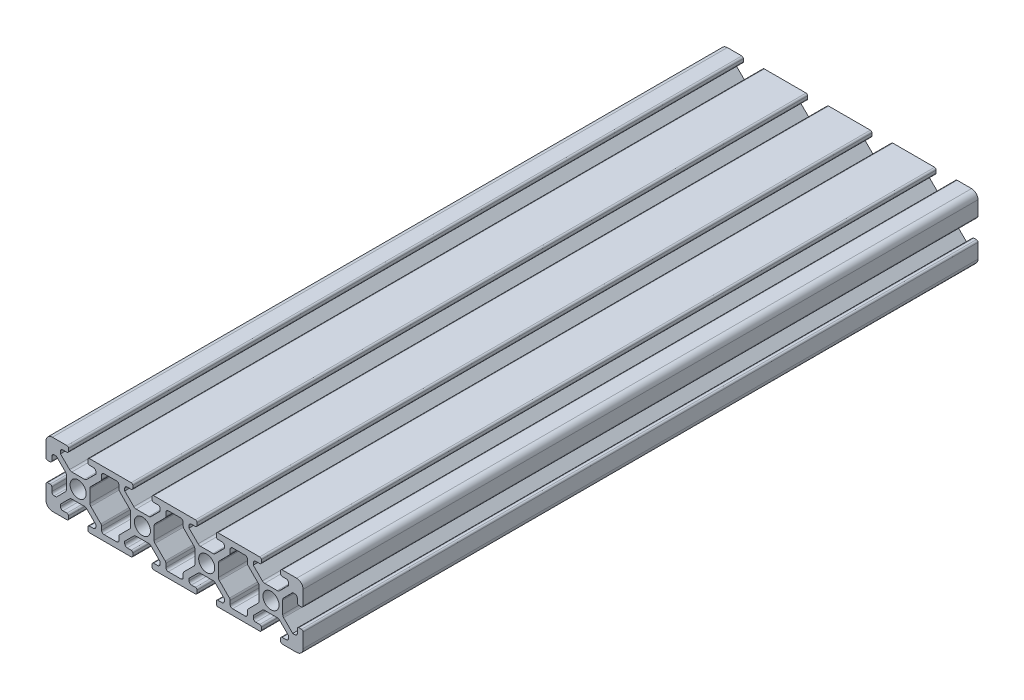
from build123d import *

# Parameters (mm, degrees)
SKETCH1_R           = 2.5
BOSS_EXTRUDE1_DEPTH = 210


with BuildPart() as part:
    # Sketch1 → Boss-Extrude1 (new body)
    with BuildSketch(Plane.XY):
        with BuildLine():
            Line((-38, -10), (-33.5, -10))
            ThreePointArc((-33.5, -10), (-33.146446609, -9.853553391), (-33, -9.5))
            Line((-33, -9.5), (-33, -8.7))
            ThreePointArc((-33, -8.7), (-33.146446609, -8.346446609), (-33.5, -8.2))
            Line((-33.5, -8.2), (-34.75, -8.2))
            ThreePointArc((-34.75, -8.2), (-35.280330086, -7.980330086), (-35.5, -7.45))
            Line((-35.5, -7.45), (-35.5, -6.772792206))
            Line((-35.5, -6.772792206), (-32.670101013, -3.942893219))
            ThreePointArc((-32.670101013, -3.942893219), (-32.345677664, -3.726120467), (-31.962994231, -3.65))
            Line((-31.962994231, -3.65), (-28.037005769, -3.65))
            ThreePointArc((-28.037005769, -3.65), (-27.654322336, -3.726120467), (-27.329898987, -3.942893219))
            Line((-27.329898987, -3.942893219), (-24.5, -6.772792206))
            Line((-24.5, -6.772792206), (-24.5, -7.45))
            ThreePointArc((-24.5, -7.45), (-24.719669914, -7.980330086), (-25.25, -8.2))
            Line((-25.25, -8.2), (-26.5, -8.2))
            ThreePointArc((-26.5, -8.2), (-26.853553391, -8.346446609), (-27, -8.7))
            Line((-27, -8.7), (-27, -9.5))
            ThreePointArc((-27, -9.5), (-26.853553391, -9.853553391), (-26.5, -10))
            Line((-26.5, -10), (-13.5, -10))
            ThreePointArc((-13.5, -10), (-13.146446609, -9.853553391), (-13, -9.5))
            Line((-13, -9.5), (-13, -8.7))
            ThreePointArc((-13, -8.7), (-13.146446609, -8.346446609), (-13.5, -8.2))
            Line((-13.5, -8.2), (-14.75, -8.2))
            ThreePointArc((-14.75, -8.2), (-15.280330086, -7.980330086), (-15.5, -7.45))
            Line((-15.5, -7.45), (-15.5, -6.772792206))
            Line((-15.5, -6.772792206), (-12.670101013, -3.942893219))
            ThreePointArc((-12.670101013, -3.942893219), (-12.345677664, -3.726120467), (-11.962994231, -3.65))
            Line((-11.962994231, -3.65), (-8.037005769, -3.65))
            ThreePointArc((-8.037005769, -3.65), (-7.654322336, -3.726120467), (-7.329898987, -3.942893219))
            Line((-7.329898987, -3.942893219), (-4.5, -6.772792206))
            Line((-4.5, -6.772792206), (-4.5, -7.45))
            ThreePointArc((-4.5, -7.45), (-4.719669914, -7.980330086), (-5.25, -8.2))
            Line((-5.25, -8.2), (-6.5, -8.2))
            ThreePointArc((-6.5, -8.2), (-6.853553391, -8.346446609), (-7, -8.7))
            Line((-7, -8.7), (-7, -9.5))
            ThreePointArc((-7, -9.5), (-6.853553391, -9.853553391), (-6.5, -10))
            Line((-6.5, -10), (6.5, -10))
            ThreePointArc((6.5, -10), (6.853553391, -9.853553391), (7, -9.5))
            Line((7, -9.5), (7, -8.7))
            ThreePointArc((7, -8.7), (6.853553391, -8.346446609), (6.5, -8.2))
            Line((6.5, -8.2), (5.25, -8.2))
            ThreePointArc((5.25, -8.2), (4.719669914, -7.980330086), (4.5, -7.45))
            Line((4.5, -7.45), (4.5, -6.772792206))
            Line((4.5, -6.772792206), (7.329898987, -3.942893219))
            ThreePointArc((7.329898987, -3.942893219), (7.654322336, -3.726120467), (8.037005769, -3.65))
            Line((8.037005769, -3.65), (11.962994231, -3.65))
            ThreePointArc((11.962994231, -3.65), (12.345677664, -3.726120467), (12.670101013, -3.942893219))
            Line((12.670101013, -3.942893219), (15.5, -6.772792206))
            Line((15.5, -6.772792206), (15.5, -7.45))
            ThreePointArc((15.5, -7.45), (15.280330086, -7.980330086), (14.75, -8.2))
            Line((14.75, -8.2), (13.5, -8.2))
            ThreePointArc((13.5, -8.2), (13.146446609, -8.346446609), (13, -8.7))
            Line((13, -8.7), (13, -9.5))
            ThreePointArc((13, -9.5), (13.146446609, -9.853553391), (13.5, -10))
            Line((13.5, -10), (26.5, -10))
            ThreePointArc((26.5, -10), (26.853553391, -9.853553391), (27, -9.5))
            Line((27, -9.5), (27, -8.7))
            ThreePointArc((27, -8.7), (26.853553391, -8.346446609), (26.5, -8.2))
            Line((26.5, -8.2), (25.25, -8.2))
            ThreePointArc((25.25, -8.2), (24.719669914, -7.980330086), (24.5, -7.45))
            Line((24.5, -7.45), (24.5, -6.772792206))
            Line((24.5, -6.772792206), (27.329898987, -3.942893219))
            ThreePointArc((27.329898987, -3.942893219), (27.654322336, -3.726120467), (28.037005769, -3.65))
            Line((28.037005769, -3.65), (31.962994231, -3.65))
            ThreePointArc((31.962994231, -3.65), (32.345677664, -3.726120467), (32.670101013, -3.942893219))
            Line((32.670101013, -3.942893219), (35.5, -6.772792206))
            Line((35.5, -6.772792206), (35.5, -7.45))
            ThreePointArc((35.5, -7.45), (35.280330086, -7.980330086), (34.75, -8.2))
            Line((34.75, -8.2), (33.5, -8.2))
            ThreePointArc((33.5, -8.2), (33.146446609, -8.346446609), (33, -8.7))
            Line((33, -8.7), (33, -9.5))
            ThreePointArc((33, -9.5), (33.146446609, -9.853553391), (33.5, -10))
            Line((33.5, -10), (38, -10))
            ThreePointArc((38, -10), (39.414213562, -9.414213562), (40, -8))
            Line((40, -8), (40, -3.5))
            ThreePointArc((40, -3.5), (39.853553391, -3.146446609), (39.5, -3))
            Line((39.5, -3), (38.7, -3))
            ThreePointArc((38.7, -3), (38.346446609, -3.146446609), (38.2, -3.5))
            Line((38.2, -3.5), (38.2, -4.75))
            ThreePointArc((38.2, -4.75), (37.980330086, -5.280330086), (37.45, -5.5))
            Line((37.45, -5.5), (36.772792206, -5.5))
            Line((36.772792206, -5.5), (33.942893219, -2.670101013))
            ThreePointArc((33.942893219, -2.670101013), (33.726120467, -2.345677664), (33.65, -1.962994231))
            Line((33.65, -1.962994231), (33.65, 1.962994231))
            ThreePointArc((33.65, 1.962994231), (33.726120467, 2.345677664), (33.942893219, 2.670101013))
            Line((33.942893219, 2.670101013), (36.772792206, 5.5))
            Line((36.772792206, 5.5), (37.45, 5.5))
            ThreePointArc((37.45, 5.5), (37.980330086, 5.280330086), (38.2, 4.75))
            Line((38.2, 4.75), (38.2, 3.5))
            ThreePointArc((38.2, 3.5), (38.346446609, 3.146446609), (38.7, 3))
            Line((38.7, 3), (39.5, 3))
            ThreePointArc((39.5, 3), (39.853553391, 3.146446609), (40, 3.5))
            Line((40, 3.5), (40, 8))
            ThreePointArc((40, 8), (39.414213562, 9.414213562), (38, 10))
            Line((38, 10), (33.5, 10))
            ThreePointArc((33.5, 10), (33.146446609, 9.853553391), (33, 9.5))
            Line((33, 9.5), (33, 8.7))
            ThreePointArc((33, 8.7), (33.146446609, 8.346446609), (33.5, 8.2))
            Line((33.5, 8.2), (34.75, 8.2))
            ThreePointArc((34.75, 8.2), (35.280330086, 7.980330086), (35.5, 7.45))
            Line((35.5, 7.45), (35.5, 6.772792206))
            Line((35.5, 6.772792206), (32.670101013, 3.942893219))
            ThreePointArc((32.670101013, 3.942893219), (32.345677664, 3.726120467), (31.962994231, 3.65))
            Line((31.962994231, 3.65), (28.037005769, 3.65))
            ThreePointArc((28.037005769, 3.65), (27.654322336, 3.726120467), (27.329898987, 3.942893219))
            Line((27.329898987, 3.942893219), (24.5, 6.772792206))
            Line((24.5, 6.772792206), (24.5, 7.45))
            ThreePointArc((24.5, 7.45), (24.719669914, 7.980330086), (25.25, 8.2))
            Line((25.25, 8.2), (26.5, 8.2))
            ThreePointArc((26.5, 8.2), (26.853553391, 8.346446609), (27, 8.7))
            Line((27, 8.7), (27, 9.5))
            ThreePointArc((27, 9.5), (26.853553391, 9.853553391), (26.5, 10))
            Line((26.5, 10), (13.5, 10))
            ThreePointArc((13.5, 10), (13.146446609, 9.853553391), (13, 9.5))
            Line((13, 9.5), (13, 8.7))
            ThreePointArc((13, 8.7), (13.146446609, 8.346446609), (13.5, 8.2))
            Line((13.5, 8.2), (14.75, 8.2))
            ThreePointArc((14.75, 8.2), (15.280330086, 7.980330086), (15.5, 7.45))
            Line((15.5, 7.45), (15.5, 6.772792206))
            Line((15.5, 6.772792206), (12.670101013, 3.942893219))
            ThreePointArc((12.670101013, 3.942893219), (12.345677664, 3.726120467), (11.962994231, 3.65))
            Line((11.962994231, 3.65), (8.037005769, 3.65))
            ThreePointArc((8.037005769, 3.65), (7.654322336, 3.726120467), (7.329898987, 3.942893219))
            Line((7.329898987, 3.942893219), (4.5, 6.772792206))
            Line((4.5, 6.772792206), (4.5, 7.45))
            ThreePointArc((4.5, 7.45), (4.719669914, 7.980330086), (5.25, 8.2))
            Line((5.25, 8.2), (6.5, 8.2))
            ThreePointArc((6.5, 8.2), (6.853553391, 8.346446609), (7, 8.7))
            Line((7, 8.7), (7, 9.5))
            ThreePointArc((7, 9.5), (6.853553391, 9.853553391), (6.5, 10))
            Line((6.5, 10), (-6.5, 10))
            ThreePointArc((-6.5, 10), (-6.853553391, 9.853553391), (-7, 9.5))
            Line((-7, 9.5), (-7, 8.7))
            ThreePointArc((-7, 8.7), (-6.853553391, 8.346446609), (-6.5, 8.2))
            Line((-6.5, 8.2), (-5.25, 8.2))
            ThreePointArc((-5.25, 8.2), (-4.719669914, 7.980330086), (-4.5, 7.45))
            Line((-4.5, 7.45), (-4.5, 6.772792206))
            Line((-4.5, 6.772792206), (-7.329898987, 3.942893219))
            ThreePointArc((-7.329898987, 3.942893219), (-7.654322336, 3.726120467), (-8.037005769, 3.65))
            Line((-8.037005769, 3.65), (-11.962994231, 3.65))
            ThreePointArc((-11.962994231, 3.65), (-12.345677664, 3.726120467), (-12.670101013, 3.942893219))
            Line((-12.670101013, 3.942893219), (-15.5, 6.772792206))
            Line((-15.5, 6.772792206), (-15.5, 7.45))
            ThreePointArc((-15.5, 7.45), (-15.280330086, 7.980330086), (-14.75, 8.2))
            Line((-14.75, 8.2), (-13.5, 8.2))
            ThreePointArc((-13.5, 8.2), (-13.146446609, 8.346446609), (-13, 8.7))
            Line((-13, 8.7), (-13, 9.5))
            ThreePointArc((-13, 9.5), (-13.146446609, 9.853553391), (-13.5, 10))
            Line((-13.5, 10), (-26.5, 10))
            ThreePointArc((-26.5, 10), (-26.853553391, 9.853553391), (-27, 9.5))
            Line((-27, 9.5), (-27, 8.7))
            ThreePointArc((-27, 8.7), (-26.853553391, 8.346446609), (-26.5, 8.2))
            Line((-26.5, 8.2), (-25.25, 8.2))
            ThreePointArc((-25.25, 8.2), (-24.719669914, 7.980330086), (-24.5, 7.45))
            Line((-24.5, 7.45), (-24.5, 6.772792206))
            Line((-24.5, 6.772792206), (-27.329898987, 3.942893219))
            ThreePointArc((-27.329898987, 3.942893219), (-27.654322336, 3.726120467), (-28.037005769, 3.65))
            Line((-28.037005769, 3.65), (-31.962994231, 3.65))
            ThreePointArc((-31.962994231, 3.65), (-32.345677664, 3.726120467), (-32.670101013, 3.942893219))
            Line((-32.670101013, 3.942893219), (-35.5, 6.772792206))
            Line((-35.5, 6.772792206), (-35.5, 7.45))
            ThreePointArc((-35.5, 7.45), (-35.280330086, 7.980330086), (-34.75, 8.2))
            Line((-34.75, 8.2), (-33.5, 8.2))
            ThreePointArc((-33.5, 8.2), (-33.146446609, 8.346446609), (-33, 8.7))
            Line((-33, 8.7), (-33, 9.5))
            ThreePointArc((-33, 9.5), (-33.146446609, 9.853553391), (-33.5, 10))
            Line((-33.5, 10), (-38, 10))
            ThreePointArc((-38, 10), (-39.414213562, 9.414213562), (-40, 8))
            Line((-40, 8), (-40, 3.5))
            ThreePointArc((-40, 3.5), (-39.853553391, 3.146446609), (-39.5, 3))
            Line((-39.5, 3), (-38.7, 3))
            ThreePointArc((-38.7, 3), (-38.346446609, 3.146446609), (-38.2, 3.5))
            Line((-38.2, 3.5), (-38.2, 4.75))
            ThreePointArc((-38.2, 4.75), (-37.980330086, 5.280330086), (-37.45, 5.5))
            Line((-37.45, 5.5), (-36.772792206, 5.5))
            Line((-36.772792206, 5.5), (-33.942893219, 2.670101013))
            ThreePointArc((-33.942893219, 2.670101013), (-33.726120467, 2.345677664), (-33.65, 1.962994231))
            Line((-33.65, 1.962994231), (-33.65, -1.962994231))
            ThreePointArc((-33.65, -1.962994231), (-33.726120467, -2.345677664), (-33.942893219, -2.670101013))
            Line((-33.942893219, -2.670101013), (-36.772792206, -5.5))
            Line((-36.772792206, -5.5), (-37.45, -5.5))
            ThreePointArc((-37.45, -5.5), (-37.980330086, -5.280330086), (-38.2, -4.75))
            Line((-38.2, -4.75), (-38.2, -3.5))
            ThreePointArc((-38.2, -3.5), (-38.346446609, -3.146446609), (-38.7, -3))
            Line((-38.7, -3), (-39.5, -3))
            ThreePointArc((-39.5, -3), (-39.853553391, -3.146446609), (-40, -3.5))
            Line((-40, -3.5), (-40, -8))
            ThreePointArc((-40, -8), (-39.414213562, -9.414213562), (-38, -10))
        make_face()
        with Locations((-30, 0)):
            Circle(SKETCH1_R, mode=Mode.SUBTRACT)
        with Locations((-10, 0)):
            Circle(SKETCH1_R, mode=Mode.SUBTRACT)
        with Locations((10, 0)):
            Circle(SKETCH1_R, mode=Mode.SUBTRACT)
        with Locations((30, 0)):
            Circle(SKETCH1_R, mode=Mode.SUBTRACT)
        with BuildLine():
            Line((-6.057106781, 2.670101013), (-2.919669914, 5.80753788))
            ThreePointArc((-2.919669914, 5.80753788), (-2.757090351, 6.050855391), (-2.7, 6.337867966))
            Line((-2.7, 6.337867966), (-2.7, 7.45))
            ThreePointArc((-2.7, 7.45), (-2.480330086, 7.980330086), (-1.95, 8.2))
            Line((-1.95, 8.2), (1.95, 8.2))
            ThreePointArc((1.95, 8.2), (2.480330086, 7.980330086), (2.7, 7.45))
            Line((2.7, 7.45), (2.7, 6.337867966))
            ThreePointArc((2.7, 6.337867966), (2.757090351, 6.050855391), (2.919669914, 5.80753788))
            Line((2.919669914, 5.80753788), (6.057106781, 2.670101013))
            ThreePointArc((6.057106781, 2.670101013), (6.273879533, 2.345677664), (6.35, 1.962994231))
            Line((6.35, 1.962994231), (6.35, -1.962994231))
            ThreePointArc((6.35, -1.962994231), (6.273879533, -2.345677664), (6.057106781, -2.670101013))
            Line((6.057106781, -2.670101013), (2.919669914, -5.80753788))
            ThreePointArc((2.919669914, -5.80753788), (2.757090351, -6.050855391), (2.7, -6.337867966))
            Line((2.7, -6.337867966), (2.7, -7.45))
            ThreePointArc((2.7, -7.45), (2.480330086, -7.980330086), (1.95, -8.2))
            Line((1.95, -8.2), (-1.95, -8.2))
            ThreePointArc((-1.95, -8.2), (-2.480330086, -7.980330086), (-2.7, -7.45))
            Line((-2.7, -7.45), (-2.7, -6.337867966))
            ThreePointArc((-2.7, -6.337867966), (-2.757090351, -6.050855391), (-2.919669914, -5.80753788))
            Line((-2.919669914, -5.80753788), (-6.057106781, -2.670101013))
            ThreePointArc((-6.057106781, -2.670101013), (-6.273879533, -2.345677664), (-6.35, -1.962994231))
            Line((-6.35, -1.962994231), (-6.35, 1.962994231))
            ThreePointArc((-6.35, 1.962994231), (-6.273879533, 2.345677664), (-6.057106781, 2.670101013))
        make_face(mode=Mode.SUBTRACT)
        with BuildLine():
            Line((-17.080330086, 5.80753788), (-13.942893219, 2.670101013))
            ThreePointArc((-13.942893219, 2.670101013), (-13.726120467, 2.345677664), (-13.65, 1.962994231))
            Line((-13.65, 1.962994231), (-13.65, -1.962994231))
            ThreePointArc((-13.65, -1.962994231), (-13.726120467, -2.345677664), (-13.942893219, -2.670101013))
            Line((-13.942893219, -2.670101013), (-17.080330086, -5.80753788))
            ThreePointArc((-17.080330086, -5.80753788), (-17.242909649, -6.050855391), (-17.3, -6.337867966))
            Line((-17.3, -6.337867966), (-17.3, -7.45))
            ThreePointArc((-17.3, -7.45), (-17.519669914, -7.980330086), (-18.05, -8.2))
            Line((-18.05, -8.2), (-21.95, -8.2))
            ThreePointArc((-21.95, -8.2), (-22.480330086, -7.980330086), (-22.7, -7.45))
            Line((-22.7, -7.45), (-22.7, -6.337867966))
            ThreePointArc((-22.7, -6.337867966), (-22.757090351, -6.050855391), (-22.919669914, -5.80753788))
            Line((-22.919669914, -5.80753788), (-26.057106781, -2.670101013))
            ThreePointArc((-26.057106781, -2.670101013), (-26.273879533, -2.345677664), (-26.35, -1.962994231))
            Line((-26.35, -1.962994231), (-26.35, 1.962994231))
            ThreePointArc((-26.35, 1.962994231), (-26.273879533, 2.345677664), (-26.057106781, 2.670101013))
            Line((-26.057106781, 2.670101013), (-22.919669914, 5.80753788))
            ThreePointArc((-22.919669914, 5.80753788), (-22.757090351, 6.050855391), (-22.7, 6.337867966))
            Line((-22.7, 6.337867966), (-22.7, 7.45))
            ThreePointArc((-22.7, 7.45), (-22.480330086, 7.980330086), (-21.95, 8.2))
            Line((-21.95, 8.2), (-18.05, 8.2))
            ThreePointArc((-18.05, 8.2), (-17.519669914, 7.980330086), (-17.3, 7.45))
            Line((-17.3, 7.45), (-17.3, 6.337867966))
            ThreePointArc((-17.3, 6.337867966), (-17.242909649, 6.050855391), (-17.080330086, 5.80753788))
        make_face(mode=Mode.SUBTRACT)
        with BuildLine():
            Line((22.919669914, 5.80753788), (26.057106781, 2.670101013))
            ThreePointArc((26.057106781, 2.670101013), (26.273879533, 2.345677664), (26.35, 1.962994231))
            Line((26.35, 1.962994231), (26.35, -1.962994231))
            ThreePointArc((26.35, -1.962994231), (26.273879533, -2.345677664), (26.057106781, -2.670101013))
            Line((26.057106781, -2.670101013), (22.919669914, -5.80753788))
            ThreePointArc((22.919669914, -5.80753788), (22.757090351, -6.050855391), (22.7, -6.337867966))
            Line((22.7, -6.337867966), (22.7, -7.45))
            ThreePointArc((22.7, -7.45), (22.480330086, -7.980330086), (21.95, -8.2))
            Line((21.95, -8.2), (18.05, -8.2))
            ThreePointArc((18.05, -8.2), (17.519669914, -7.980330086), (17.3, -7.45))
            Line((17.3, -7.45), (17.3, -6.337867966))
            ThreePointArc((17.3, -6.337867966), (17.242909649, -6.050855391), (17.080330086, -5.80753788))
            Line((17.080330086, -5.80753788), (13.942893219, -2.670101013))
            ThreePointArc((13.942893219, -2.670101013), (13.726120467, -2.345677664), (13.65, -1.962994231))
            Line((13.65, -1.962994231), (13.65, 1.962994231))
            ThreePointArc((13.65, 1.962994231), (13.726120467, 2.345677664), (13.942893219, 2.670101013))
            Line((13.942893219, 2.670101013), (17.080330086, 5.80753788))
            ThreePointArc((17.080330086, 5.80753788), (17.242909649, 6.050855391), (17.3, 6.337867966))
            Line((17.3, 6.337867966), (17.3, 7.45))
            ThreePointArc((17.3, 7.45), (17.519669914, 7.980330086), (18.05, 8.2))
            Line((18.05, 8.2), (21.95, 8.2))
            ThreePointArc((21.95, 8.2), (22.480330086, 7.980330086), (22.7, 7.45))
            Line((22.7, 7.45), (22.7, 6.337867966))
            ThreePointArc((22.7, 6.337867966), (22.757090351, 6.050855391), (22.919669914, 5.80753788))
        make_face(mode=Mode.SUBTRACT)
    extrude(amount=BOSS_EXTRUDE1_DEPTH)


solid = part.part
